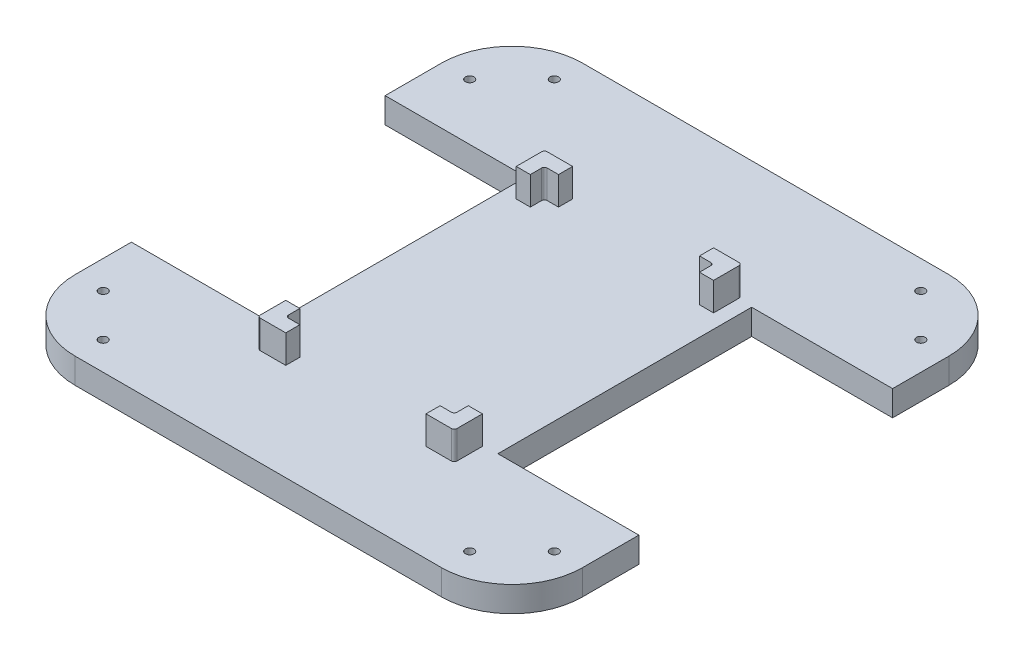
from build123d import *

# Parameters (mm, degrees)
PLATE_DEPTH               = 9
SKETCH3_R                 = 1.525
HEX_HOLES_DEPTH           = 128.597021909
RASPBERRY_PI_HOLDER_DEPTH = 10
FILLET1_R                 = 1
SKETCH5_W                 = 50
SKETCH5_H                 = 90
CUT_EXTRUDE1_DEPTH        = 128.671453348


with BuildPart() as part:
    # Sketch1 → Plate (new body)
    with BuildSketch(Plane(origin=(0, 0, 0), x_dir=(1, 0, 0), z_dir=(0, 1, 0))):
        with BuildLine():
            Line((-65, -90), (65, -90))
            ThreePointArc((65, -90), (82.67766953, -82.67766953), (90, -65))
            Line((90, -65), (90, 65))
            ThreePointArc((90, 65), (82.67766953, 82.67766953), (65, 90))
            Line((65, 90), (-65, 90))
            ThreePointArc((-65, 90), (-82.67766953, 82.67766953), (-90, 65))
            Line((-90, 65), (-90, -65))
            ThreePointArc((-90, -65), (-82.67766953, -82.67766953), (-65, -90))
        make_face()
    extrude(amount=PLATE_DEPTH)

    # Sketch3 → Hex Holes (cut, through all)
    with BuildSketch(Plane(origin=(0, 9, 0), x_dir=(1, 0, 0), z_dir=(0, 1, 0))):
        with Locations(Location((-65, 80, 0), (0, 0, 270))):
            Circle(SKETCH3_R)
        with Locations(Location((-80, 65, 0), (0, 0, 270))):
            Circle(SKETCH3_R)
        with Locations(Location((80, 65, 0), (0, 0, 270))):
            Circle(SKETCH3_R)
        with Locations(Location((80, -65, 0), (0, 0, 270))):
            Circle(SKETCH3_R)
        with Locations(Location((65, 80, 0), (0, 0, 270))):
            Circle(SKETCH3_R)
        with Locations(Location((65, -80, 0), (0, 0, 270))):
            Circle(SKETCH3_R)
        with Locations(Location((-65, -80, 0), (0, 0, 270))):
            Circle(SKETCH3_R)
        with Locations(Location((-80, -65, 0), (0, 0, 270))):
            Circle(SKETCH3_R)
    extrude(amount=-HEX_HOLES_DEPTH, mode=Mode.SUBTRACT)

    # Sketch4 → Raspberry Pi Holder (add)
    with BuildSketch(Plane(origin=(0, 9, 0), x_dir=(1, 0, 0), z_dir=(0, 1, 0))):
        Polygon((-30, 36.5), (-30, 41.5), (-25, 41.5), (-25, 46.5), (-35, 46.5), (-35, 36.5), align=None)
        Polygon((25, 46.5), (35, 46.5), (35, 36.5), (30, 36.5), (30, 41.5), (25, 41.5), align=None)
        Polygon((-34.75, -45.5), (-34.75, -55.5), (-24.75, -55.5), (-24.75, -50.5), (-29.75, -50.5), (-29.75, -45.5), align=None)
        Polygon((25, -50.5), (25, -55.5), (35, -55.5), (35, -45.5), (30, -45.5), (30, -50.5), align=None)
    extrude(amount=RASPBERRY_PI_HOLDER_DEPTH)

    # Fillet1
    fillet1_edges = [part.edges().sort_by_distance(p)[0] for p in [
        (-30, 14, -41.5),
        (-35, 14, -46.5),
        (30, 14, -41.5),
        (35, 14, -46.5),
        (-34.75, 14, 55.5),
        (-29.75, 14, 50.5),
        (35, 14, 55.5),
        (30, 14, 50.5),
    ]]
    fillet(fillet1_edges, radius=FILLET1_R)

    # Sketch5 → Cut-Extrude1 (cut, through all)
    with BuildSketch(Plane(origin=(0, 9, 0), x_dir=(1, 0, 0), z_dir=(0, 1, 0))):
        with Locations((-65, 0)):
            Rectangle(SKETCH5_W, SKETCH5_H)
        with Locations((65, 0)):
            Rectangle(SKETCH5_W, SKETCH5_H)
    extrude(amount=-CUT_EXTRUDE1_DEPTH, mode=Mode.SUBTRACT)


solid = part.part
